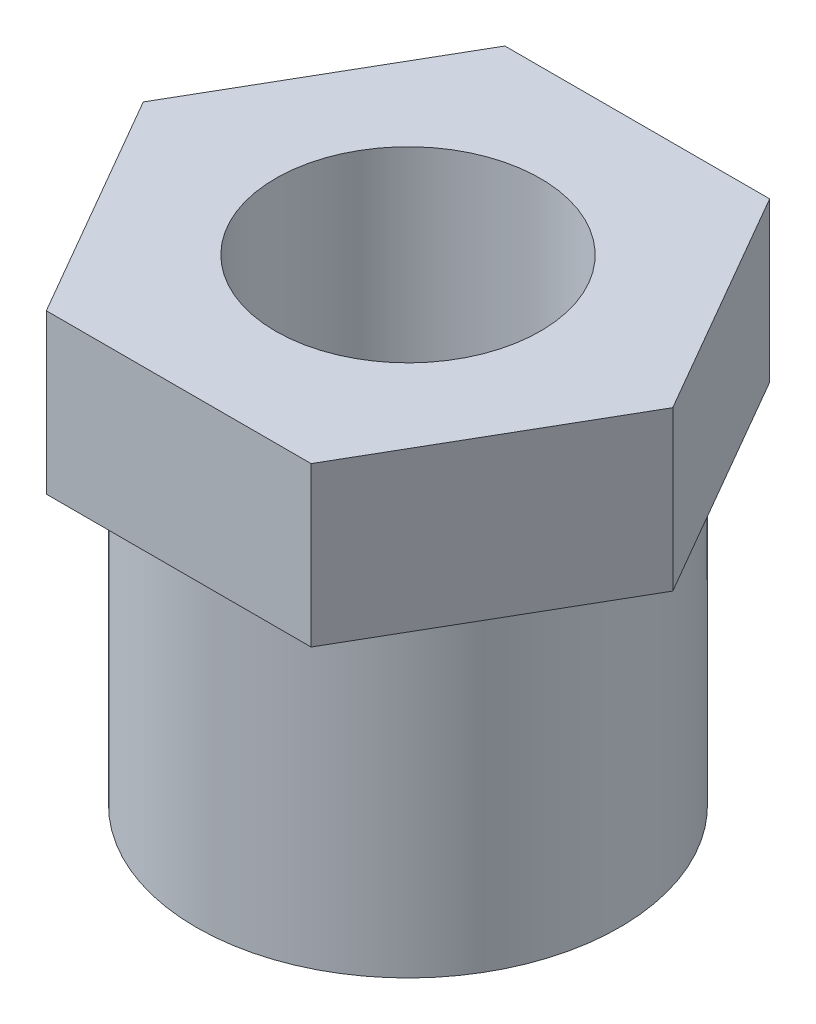
from build123d import *

# Parameters (mm, degrees)
SKETCH1_R           = 4
BOSS_EXTRUDE1_DEPTH = 6
BOSS_EXTRUDE2_DEPTH = 3
SKETCH3_R           = 2.5
CUT_EXTRUDE1_DEPTH  = 12.169153952


with BuildPart() as part:
    # Sketch1 → Boss-Extrude1 (new body)
    with BuildSketch(Plane(origin=(0, 0, 0), x_dir=(1, 0, 0), z_dir=(0, 1, 0))):
        with Locations(Location((0, 0, 0), (0, 0, 270))):
            Circle(SKETCH1_R)
    extrude(amount=BOSS_EXTRUDE1_DEPTH)

    # Sketch2 → Boss-Extrude2 (add)
    with BuildSketch(Plane(origin=(0, 6, 0), x_dir=(1, 0, 0), z_dir=(0, 1, 0))):
        Polygon((2.5, -4.330127019), (5, 0), (2.5, 4.330127019), (-2.5, 4.330127019), (-5, 0), (-2.5, -4.330127019), align=None)
    extrude(amount=BOSS_EXTRUDE2_DEPTH)

    # Sketch3 → Cut-Extrude1 (cut, through all)
    with BuildSketch(Plane(origin=(0, 9, 0), x_dir=(1, 0, 0), z_dir=(0, 1, 0))):
        with Locations(Location((0, 0, 0), (0, 0, 270))):
            Circle(SKETCH3_R)
    extrude(amount=-CUT_EXTRUDE1_DEPTH, mode=Mode.SUBTRACT)


solid = part.part
